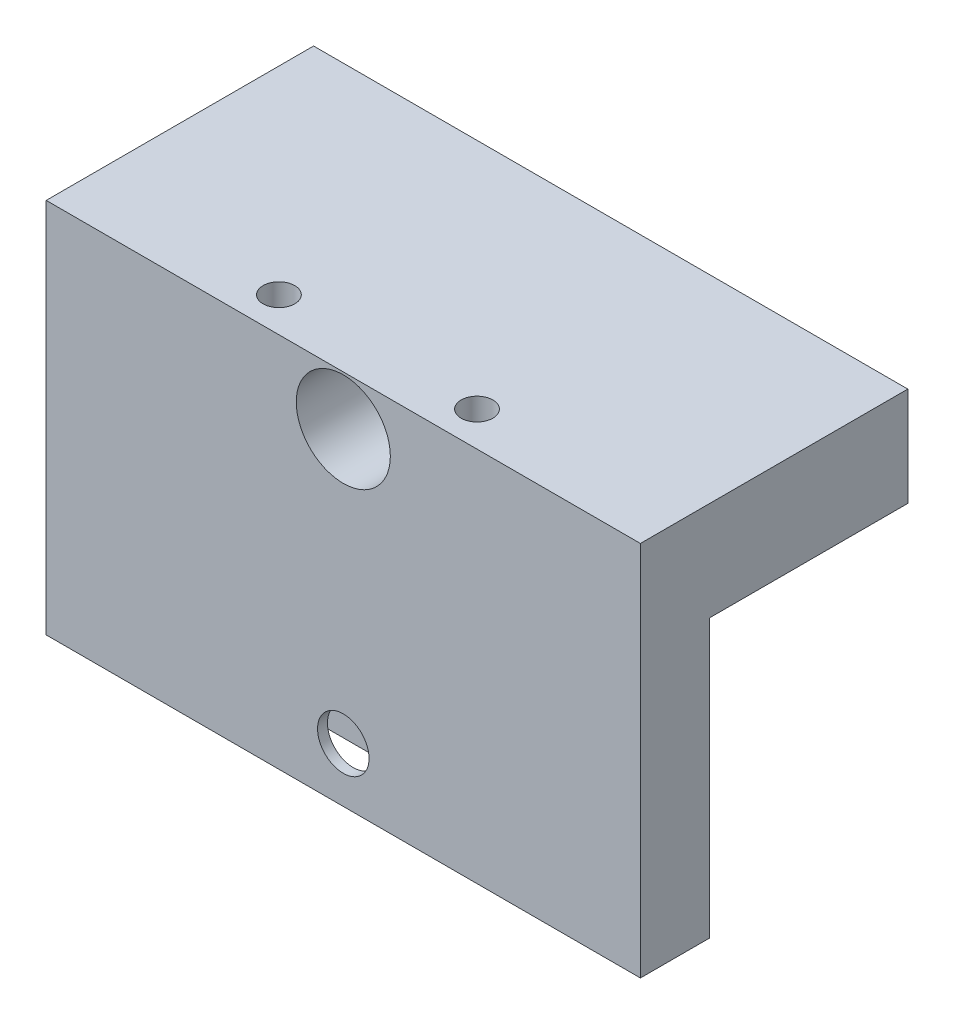
from build123d import *

# Parameters (mm, degrees)
SKETCH1_W           = 60
SKETCH1_H           = 27
BOSS_EXTRUDE1_DEPTH = 10
SKETCH2_R           = 2.6
CUT_EXTRUDE1_DEPTH  = 42.581245773
SKETCH3_R           = 4.75
CUT_EXTRUDE2_DEPTH  = 22
SKETCH4_W           = 60
SKETCH4_H           = 7
SKETCH4_W_2         = 40
SKETCH4_H_2         = 5
BOSS_EXTRUDE3_DEPTH = 28
SKETCH5_R           = 2.6
CUT_EXTRUDE3_DEPTH  = 50.122296363
SKETCH6_R           = 1.6
CUT_EXTRUDE4_DEPTH  = 51.261814532


with BuildPart() as part:
    # Sketch1 → Boss-Extrude1 (new body)
    with BuildSketch(Plane(origin=(0, 0, 0), x_dir=(1, 0, 0), z_dir=(0, 1, 0))):
        Rectangle(SKETCH1_W, SKETCH1_H)
    extrude(amount=BOSS_EXTRUDE1_DEPTH)

    # Sketch2 → Cut-Extrude1 (cut, through all)
    with BuildSketch(Plane.XY.offset(13.5)):
        with Locations((0, 5)):
            Circle(SKETCH2_R)
    extrude(amount=-CUT_EXTRUDE1_DEPTH, mode=Mode.SUBTRACT)

    # Sketch3 → Cut-Extrude2 (cut)
    with BuildSketch(Plane.XY.offset(13.5)):
        with Locations((0, 5)):
            Circle(SKETCH3_R)
    extrude(amount=-CUT_EXTRUDE2_DEPTH, mode=Mode.SUBTRACT)

    # Sketch4 → Boss-Extrude3 (add)
    with BuildSketch(Plane.XZ):
        with Locations((0, 10)):
            Rectangle(SKETCH4_W, SKETCH4_H)
        with Locations((0, 10)):
            Rectangle(SKETCH4_W_2, SKETCH4_H_2, mode=Mode.SUBTRACT)
    extrude(amount=BOSS_EXTRUDE3_DEPTH)

    # Sketch5 → Cut-Extrude3 (cut, through all)
    with BuildSketch(Plane.XY.offset(13.5)):
        with Locations((0, -22.5)):
            Circle(SKETCH5_R)
    extrude(amount=-CUT_EXTRUDE3_DEPTH, mode=Mode.SUBTRACT)

    # Sketch6 → Cut-Extrude4 (cut, through all)
    with BuildSketch(Plane(origin=(0, 10, 0), x_dir=(1, 0, 0), z_dir=(0, 1, 0))):
        with Locations(Location((-10, -10, 0), (0, 0, 270))):
            Circle(SKETCH6_R)
        with Locations(Location((10, -10, 0), (0, 0, 270))):
            Circle(SKETCH6_R)
    extrude(amount=-CUT_EXTRUDE4_DEPTH, mode=Mode.SUBTRACT)


solid = part.part
